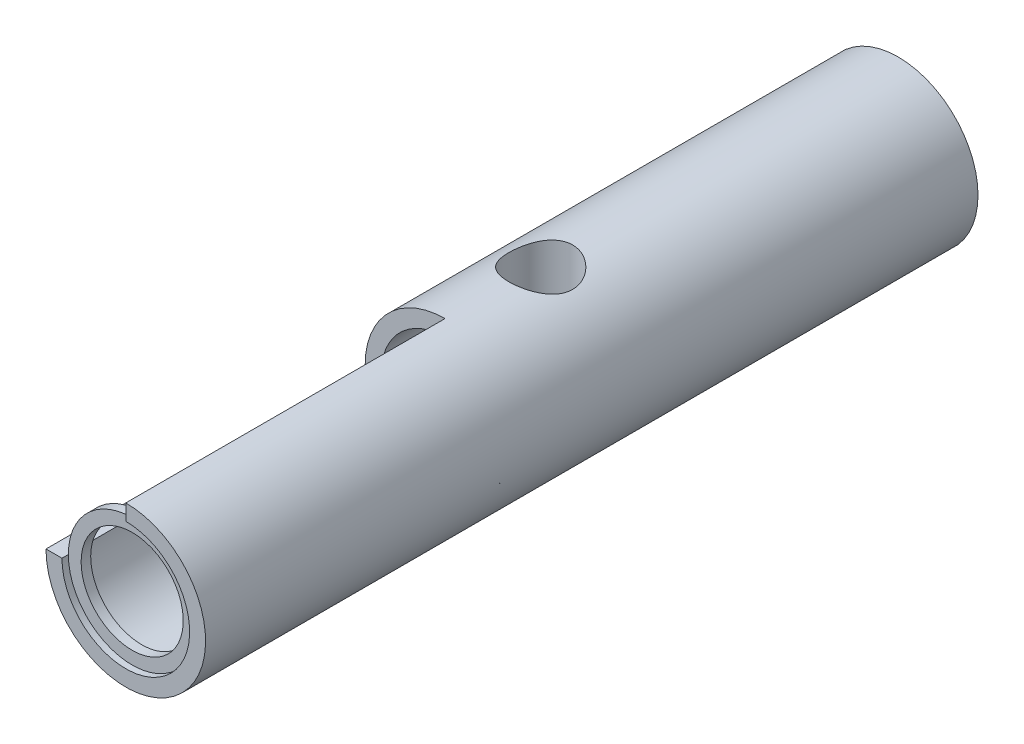
from build123d import *

# Parameters (mm, degrees)
ESQUISSE1_R                  = 12.5
BASE_EXTRUSION_DEPTH         = 121
ESQUISSE2_R                  = 10
ENL_V_MAT_EXTRU_1_DEPTH      = 58
ESQUISSE3_R                  = 4
ENL_V_MAT_EXTRU_2_DEPTH      = 66.433172015
ENL_V_MAT_EXTRU_3_DEPTH      = 15
ENL_V_MAT_EXTRU_3_DEPTH_BACK = 8
ESQUISSE4_R                  = 5
ESQUISSE5_R                  = 3
ENL_V_MAT_EXTRU_4_DEPTH      = 124.35923164
ESQUISSE9_W                  = 55
ESQUISSE9_H                  = 32.337681811
ENL_V_MAT_EXTRU_6_DEPTH      = 123.284504454
ESQUISSE6_W                  = 1.5
ESQUISSE6_H                  = 2


with BuildPart() as part:
    # Esquisse1 → Base-Extrusion (new body)
    with BuildSketch(Plane.XY):
        Circle(ESQUISSE1_R)
    extrude(amount=BASE_EXTRUSION_DEPTH)

    # Esquisse2 → Enlèv. mat.-Extru.1 (cut)
    with BuildSketch(Plane.XY.offset(121)):
        Circle(ESQUISSE2_R)
    extrude(amount=-ENL_V_MAT_EXTRU_1_DEPTH, mode=Mode.SUBTRACT)

    # Esquisse3 → Enlèv. mat.-Extru.2 (cut, through all)
    with BuildSketch(Plane.XY.offset(63)):
        Circle(ESQUISSE3_R)
    extrude(amount=-ENL_V_MAT_EXTRU_2_DEPTH, mode=Mode.SUBTRACT)

    # Esquisse4 → Enlèv. mat.-Extru.3 (cut, two sides: drawn at the far end of the back side and taken through both)
    with BuildSketch(Plane(origin=(0, 0, 0), x_dir=(-1, 0, 0), z_dir=(0, 1, 0)).offset(-ENL_V_MAT_EXTRU_3_DEPTH_BACK)):
        with Locations((0, 56)):
            Circle(ESQUISSE4_R)
    extrude(amount=ENL_V_MAT_EXTRU_3_DEPTH + ENL_V_MAT_EXTRU_3_DEPTH_BACK, mode=Mode.SUBTRACT)

    # Esquisse5 → Enlèv. mat.-Extru.4 (cut, through all)
    with BuildSketch(Plane(origin=(0, -8, 0), x_dir=(-1, 0, 0), z_dir=(0, 1, 0))):
        with Locations((0, 56)):
            Circle(ESQUISSE5_R)
    extrude(amount=-ENL_V_MAT_EXTRU_4_DEPTH, mode=Mode.SUBTRACT)

    # Esquisse9 → Enlèv. mat.-Extru.6 (cut, through all)
    with BuildSketch(Plane(origin=(0, 0, 0), x_dir=(0, 0, -1), z_dir=(1, 0, 0))):
        with Locations((-98.5, 16.168840906)):
            Rectangle(ESQUISSE9_W, ESQUISSE9_H)
    extrude(amount=-ENL_V_MAT_EXTRU_6_DEPTH, mode=Mode.SUBTRACT)

    # Esquisse6 → Anneau élastique (revolve)
    with BuildSketch(Plane(origin=(0, 0, 0), x_dir=(0, 0, -1), z_dir=(1, 0, 0))):
        with Locations((-119.25, 9)):
            Rectangle(ESQUISSE6_W, ESQUISSE6_H)
    revolve(axis=Axis((0, 0, -6.276986183), (0, 0, 1)))


solid = part.part
